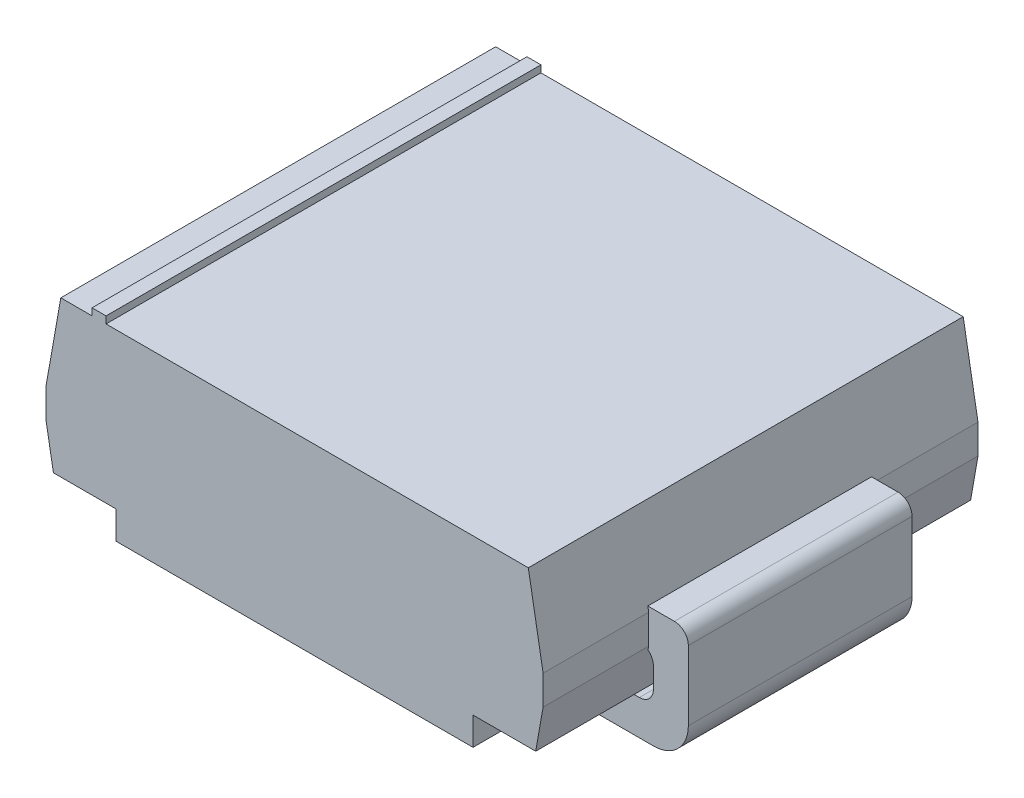
from build123d import *
from OCP.BRepFilletAPI import BRepFilletAPI_MakeChamfer

# Parameters (mm, degrees)
SKETCH_1_W           = 7.11
SKETCH_1_H           = 6.22
EXTRUDE_1_DEPTH      = 2.62
CHAMFER_1_SIZE       = 1.2
CHAMFER_1_SIZE2      = 0.211592377
CHAMFER_2_SIZE       = 1
CHAMFER_2_SIZE2      = 0.176326981
SKETCH_3_W           = 1.589547356
SKETCH_3_H           = 0.4
CUT_EXTRUDE_1_DEPTH  = 8.628291093
EXTRUDE_2_DEPTH      = 1.6
EXTRUDE_2_DEPTH_BACK = 1.6
SKETCH_4_W           = 0.2
SKETCH_4_H           = 6.22
EXTRUDE_3_DEPTH      = 0.1


with BuildPart() as part:
    # 草图1 → 凸台-拉伸1 (new body)
    with BuildSketch(Plane(origin=(0, 0, 0), x_dir=(1, 0, 0), z_dir=(0, 1, 0))):
        Rectangle(SKETCH_1_W, SKETCH_1_H)
    extrude(amount=EXTRUDE_1_DEPTH)

    # 倒角1: one chamfer whose edges measure the first distance from different faces: ONE call of the kernel's chamfer builder (chamfer() names one face for all edges)
    chamfer_1_edges_1 = [part.edges().sort_by_distance(p)[0] for p in [
        (3.555, 2.62, 0),
    ]]
    chamfer_1_side_1 = [part.faces().sort_by_distance(p)[0] for p in [
        (3.555, 1.31, 0),
    ]]
    chamfer_1_edges_2 = [part.edges().sort_by_distance(p)[0] for p in [
        (-3.555, 2.62, 0),
    ]]
    chamfer_1_side_2 = [part.faces().sort_by_distance(p)[0] for p in [
        (-3.555, 1.31, 0),
    ]]
    chamfer_1 = BRepFilletAPI_MakeChamfer(part.part.solid().wrapped)
    for e in chamfer_1_edges_1:
        chamfer_1.Add(CHAMFER_1_SIZE, CHAMFER_1_SIZE2, e.wrapped, chamfer_1_side_1[0].wrapped)  # the first distance lies on this face
    for e in chamfer_1_edges_2:
        chamfer_1.Add(CHAMFER_1_SIZE, CHAMFER_1_SIZE2, e.wrapped, chamfer_1_side_2[0].wrapped)  # the first distance lies on this face
    add(Compound.cast(chamfer_1.Shape()), mode=Mode.REPLACE)

    # 倒角2: one chamfer whose edges measure the first distance from different faces: ONE call of the kernel's chamfer builder (chamfer() names one face for all edges)
    chamfer_2_edges_1 = [part.edges().sort_by_distance(p)[0] for p in [
        (3.555, 0, 0),
    ]]
    chamfer_2_side_1 = [part.faces().sort_by_distance(p)[0] for p in [
        (3.555, 0.71, 0),
    ]]
    chamfer_2_edges_2 = [part.edges().sort_by_distance(p)[0] for p in [
        (-3.555, 0, 0),
    ]]
    chamfer_2_side_2 = [part.faces().sort_by_distance(p)[0] for p in [
        (-3.555, 0.71, 0),
    ]]
    chamfer_2 = BRepFilletAPI_MakeChamfer(part.part.solid().wrapped)
    for e in chamfer_2_edges_1:
        chamfer_2.Add(CHAMFER_2_SIZE, CHAMFER_2_SIZE2, e.wrapped, chamfer_2_side_1[0].wrapped)  # the first distance lies on this face
    for e in chamfer_2_edges_2:
        chamfer_2.Add(CHAMFER_2_SIZE, CHAMFER_2_SIZE2, e.wrapped, chamfer_2_side_2[0].wrapped)  # the first distance lies on this face
    add(Compound.cast(chamfer_2.Shape()), mode=Mode.REPLACE)

    # 草图3 → 切除-拉伸1 (cut, through all)
    with BuildSketch(Plane.XY.offset(3.11)):
        with Locations((-3.34769153, 0.2)):
            Rectangle(SKETCH_3_W, SKETCH_3_H)
        with Locations((3.34769153, 0.2)):
            Rectangle(SKETCH_3_W, SKETCH_3_H)
    extrude(amount=-CUT_EXTRUDE_1_DEPTH, mode=Mode.SUBTRACT)

    # 草图2 → 凸台-拉伸2 (add, two sides: drawn at the far end of the back side and taken through both)
    with BuildSketch(Plane.XY.offset(-EXTRUDE_2_DEPTH_BACK)):
        with BuildLine():
            Line((3.311187824, 0.990859164), (3.311187824, 1.490859164))
            Line((3.311187824, 1.490859164), (3.922104584, 1.490859164))
            ThreePointArc((3.922104584, 1.490859164), (4.063525941, 1.43228052), (4.122104584, 1.290859164))
            Line((4.122104584, 1.290859164), (4.122104584, 0.297))
            ThreePointArc((4.122104584, 0.297), (3.975657975, -0.056553391), (3.622104584, -0.203))
            Line((3.622104584, -0.203), (2.711617897, -0.203))
            Line((2.711617897, -0.203), (2.711617897, 0.297))
            Line((2.711617897, 0.297), (3.422104584, 0.297))
            ThreePointArc((3.422104584, 0.297), (3.563525941, 0.355578644), (3.622104584, 0.497))
            Line((3.622104584, 0.497), (3.622104584, 0.790859164))
            ThreePointArc((3.622104584, 0.790859164), (3.563525941, 0.93228052), (3.422104584, 0.990859164))
            Line((3.422104584, 0.990859164), (3.311187824, 0.990859164))
        make_face()
        with BuildLine():
            Line((-3.311187824, 0.990859164), (-3.422104584, 0.990859164))
            ThreePointArc((-3.422104584, 0.990859164), (-3.563525941, 0.93228052), (-3.622104584, 0.790859164))
            Line((-3.622104584, 0.790859164), (-3.622104584, 0.497))
            ThreePointArc((-3.622104584, 0.497), (-3.563525941, 0.355578644), (-3.422104584, 0.297))
            Line((-3.422104584, 0.297), (-2.711617897, 0.297))
            Line((-2.711617897, 0.297), (-2.711617897, -0.203))
            Line((-2.711617897, -0.203), (-3.622104584, -0.203))
            ThreePointArc((-3.622104584, -0.203), (-3.975657975, -0.056553391), (-4.122104584, 0.297))
            Line((-4.122104584, 0.297), (-4.122104584, 1.290859164))
            ThreePointArc((-4.122104584, 1.290859164), (-4.063525941, 1.43228052), (-3.922104584, 1.490859164))
            Line((-3.922104584, 1.490859164), (-3.311187824, 1.490859164))
            Line((-3.311187824, 1.490859164), (-3.311187824, 0.990859164))
        make_face()
    extrude(amount=EXTRUDE_2_DEPTH + EXTRUDE_2_DEPTH_BACK)

    # 草图4 → 凸台-拉伸3 (add)
    with BuildSketch(Plane(origin=(0, 2.62, 0), x_dir=(1, 0, 0), z_dir=(0, 1, 0))):
        with Locations((-2.796130455, 0)):
            Rectangle(SKETCH_4_W, SKETCH_4_H)
    extrude(amount=EXTRUDE_3_DEPTH)


solid = part.part
